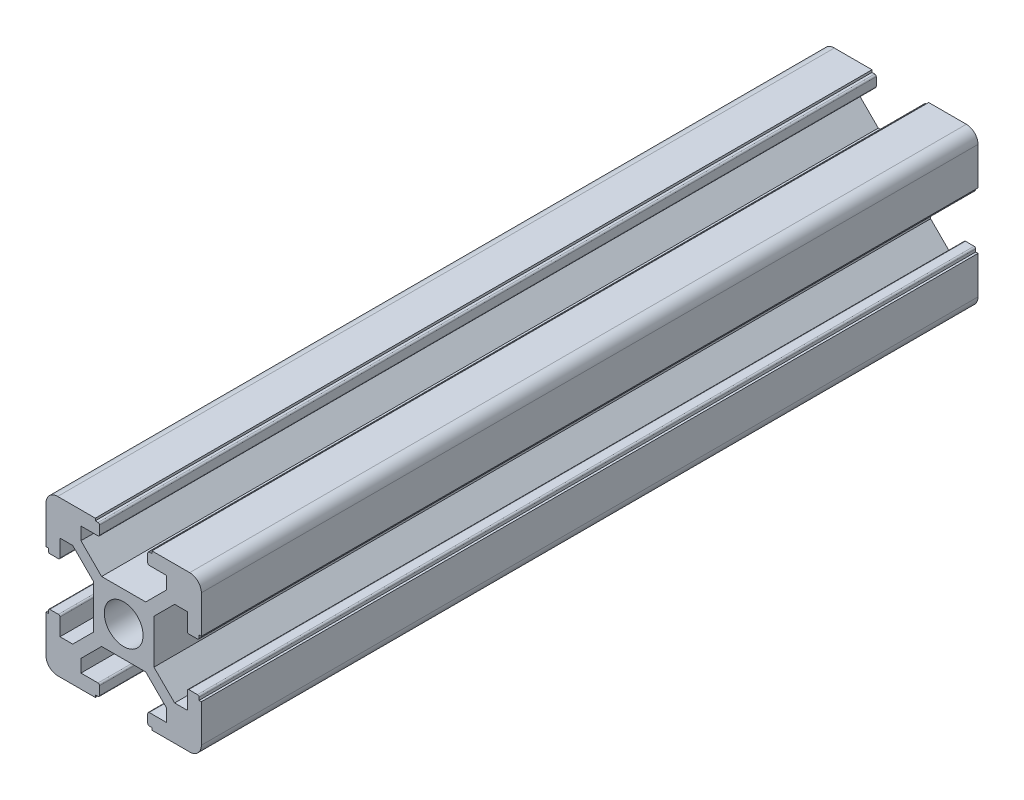
from build123d import *

# Parameters (mm, degrees)
SKETCH_1_R      = 2.5
EXTRUDE_2_DEPTH = 100
EXTRUDE_3_DEPTH = 100


with BuildPart() as part:
    # 草图1 → 凸台-拉伸2 (new body)
    with BuildSketch(Plane.XY):
        with BuildLine():
            Line((3.65, 10), (8.5, 10))
            ThreePointArc((8.5, 10), (9.560660172, 9.560660172), (10, 8.5))
            Line((10, 8.5), (10, 3.65))
            Line((10, 3.65), (8.2, 3.65))
            Line((8.2, 3.65), (8.2, 5.5))
            Line((8.2, 5.5), (6.560660172, 5.5))
            Line((6.560660172, 5.5), (3.9, 2.839339828))
            Line((3.9, 2.839339828), (3.9, -2.839339828))
            Line((3.9, -2.839339828), (6.560660172, -5.5))
            Line((6.560660172, -5.5), (8.2, -5.5))
            Line((8.2, -5.5), (8.2, -3.65))
            Line((8.2, -3.65), (10, -3.65))
            Line((10, -3.65), (10, -8.5))
            ThreePointArc((10, -8.5), (9.560660172, -9.560660172), (8.5, -10))
            Line((8.5, -10), (3.65, -10))
            Line((3.65, -10), (3.65, -8.2))
            Line((3.65, -8.2), (5.5, -8.2))
            Line((5.5, -8.2), (5.5, -6.560660172))
            Line((5.5, -6.560660172), (2.839339828, -3.9))
            Line((2.839339828, -3.9), (-2.839339828, -3.9))
            Line((-2.839339828, -3.9), (-5.5, -6.560660172))
            Line((-5.5, -6.560660172), (-5.5, -8.2))
            Line((-5.5, -8.2), (-3.65, -8.2))
            Line((-3.65, -8.2), (-3.65, -10))
            Line((-3.65, -10), (-8.5, -10))
            ThreePointArc((-8.5, -10), (-9.560660172, -9.560660172), (-10, -8.5))
            Line((-10, -8.5), (-10, -3.65))
            Line((-10, -3.65), (-8.2, -3.65))
            Line((-8.2, -3.65), (-8.2, -5.5))
            Line((-8.2, -5.5), (-6.560660172, -5.5))
            Line((-6.560660172, -5.5), (-3.9, -2.839339828))
            Line((-3.9, -2.839339828), (-3.9, 2.839339828))
            Line((-3.9, 2.839339828), (-6.560660172, 5.5))
            Line((-6.560660172, 5.5), (-8.2, 5.5))
            Line((-8.2, 5.5), (-8.2, 3.65))
            Line((-8.2, 3.65), (-10, 3.65))
            Line((-10, 3.65), (-10, 8.5))
            ThreePointArc((-10, 8.5), (-9.560660172, 9.560660172), (-8.5, 10))
            Line((-8.5, 10), (-3.65, 10))
            Line((-3.65, 10), (-3.65, 8.2))
            Line((-3.65, 8.2), (-5.5, 8.2))
            Line((-5.5, 8.2), (-5.5, 6.560660172))
            Line((-5.5, 6.560660172), (-2.839339828, 3.9))
            Line((-2.839339828, 3.9), (2.839339828, 3.9))
            Line((2.839339828, 3.9), (5.5, 6.560660172))
            Line((5.5, 6.560660172), (5.5, 8.2))
            Line((5.5, 8.2), (3.65, 8.2))
            Line((3.65, 8.2), (3.65, 10))
        make_face()
        Circle(SKETCH_1_R, mode=Mode.SUBTRACT)
    extrude(amount=EXTRUDE_2_DEPTH)

    # 草图3 → 凸台-拉伸3 (add)
    with BuildSketch(Plane.XY.offset(100)):
        with BuildLine():
            Line((-8.2, 3.65), (-9.7, 3.65))
            Line((-9.7, 3.65), (-9.7, 3.3))
            ThreePointArc((-9.7, 3.3), (-9.641421356, 3.158578644), (-9.5, 3.1))
            Line((-9.5, 3.1), (-8.4, 3.1))
            ThreePointArc((-8.4, 3.1), (-8.258578644, 3.158578644), (-8.2, 3.3))
            Line((-8.2, 3.3), (-8.2, 3.65))
        make_face()
        with BuildLine():
            Line((-3.65, 9.7), (-3.65, 8.2))
            Line((-3.65, 8.2), (-3.3, 8.2))
            ThreePointArc((-3.3, 8.2), (-3.158578644, 8.258578644), (-3.1, 8.4))
            Line((-3.1, 8.4), (-3.1, 9.5))
            ThreePointArc((-3.1, 9.5), (-3.158578644, 9.641421356), (-3.3, 9.7))
            Line((-3.3, 9.7), (-3.65, 9.7))
        make_face()
        with BuildLine():
            Line((3.65, 8.2), (3.65, 9.7))
            Line((3.65, 9.7), (3.3, 9.7))
            ThreePointArc((3.3, 9.7), (3.158578644, 9.641421356), (3.1, 9.5))
            Line((3.1, 9.5), (3.1, 8.4))
            ThreePointArc((3.1, 8.4), (3.158578644, 8.258578644), (3.3, 8.2))
            Line((3.3, 8.2), (3.65, 8.2))
        make_face()
        with BuildLine():
            Line((9.7, 3.65), (8.2, 3.65))
            Line((8.2, 3.65), (8.2, 3.3))
            ThreePointArc((8.2, 3.3), (8.258578644, 3.158578644), (8.4, 3.1))
            Line((8.4, 3.1), (9.5, 3.1))
            ThreePointArc((9.5, 3.1), (9.641421356, 3.158578644), (9.7, 3.3))
            Line((9.7, 3.3), (9.7, 3.65))
        make_face()
        with BuildLine():
            Line((3.65, -9.7), (3.65, -8.2))
            Line((3.65, -8.2), (3.3, -8.2))
            ThreePointArc((3.3, -8.2), (3.158578644, -8.258578644), (3.1, -8.4))
            Line((3.1, -8.4), (3.1, -9.5))
            ThreePointArc((3.1, -9.5), (3.158578644, -9.641421356), (3.3, -9.7))
            Line((3.3, -9.7), (3.65, -9.7))
        make_face()
        with BuildLine():
            Line((-3.65, -8.2), (-3.65, -9.7))
            Line((-3.65, -9.7), (-3.3, -9.7))
            ThreePointArc((-3.3, -9.7), (-3.158578644, -9.641421356), (-3.1, -9.5))
            Line((-3.1, -9.5), (-3.1, -8.4))
            ThreePointArc((-3.1, -8.4), (-3.158578644, -8.258578644), (-3.3, -8.2))
            Line((-3.3, -8.2), (-3.65, -8.2))
        make_face()
        with BuildLine():
            Line((8.2, -3.65), (8.2, -3.3))
            ThreePointArc((8.2, -3.3), (8.258578644, -3.158578644), (8.4, -3.1))
            Line((8.4, -3.1), (9.5, -3.1))
            ThreePointArc((9.5, -3.1), (9.641421356, -3.158578644), (9.7, -3.3))
            Line((9.7, -3.3), (9.7, -3.65))
            Line((9.7, -3.65), (8.2, -3.65))
        make_face()
        with BuildLine():
            Line((-8.2, -3.65), (-8.2, -3.3))
            ThreePointArc((-8.2, -3.3), (-8.258578644, -3.158578644), (-8.4, -3.1))
            Line((-8.4, -3.1), (-9.5, -3.1))
            ThreePointArc((-9.5, -3.1), (-9.641421356, -3.158578644), (-9.7, -3.3))
            Line((-9.7, -3.3), (-9.7, -3.65))
            Line((-9.7, -3.65), (-8.2, -3.65))
        make_face()
    extrude(amount=-EXTRUDE_3_DEPTH)


solid = part.part
